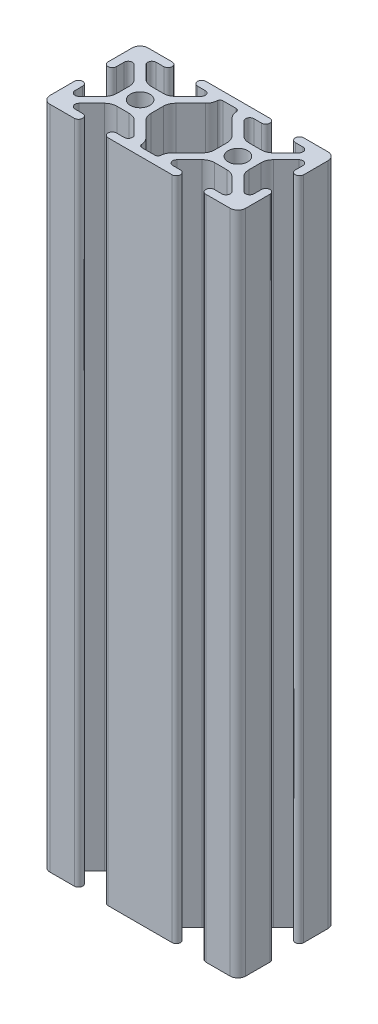
from build123d import *

# Parameters (mm, degrees)
SKETCH11_R                             = 2.5
F_25_SERIES_EXTRUSIONS_25_2550_1_DEPTH = 170


with BuildPart() as part:
    # Sketch11 → 25 series extrusions 25-2550(1) (new body)
    with BuildSketch(Plane(origin=(0, 0, 0), x_dir=(-1, 0, 0), z_dir=(0, 1, 0))):
        with BuildLine():
            Line((8.185, 12.5), (-8.185, 12.5))
            ThreePointArc((-8.185, 12.5), (-9.25, 11.435), (-8.185, 10.37))
            Line((-8.185, 10.37), (-6.227198013, 10.37))
            ThreePointArc((-6.227198013, 10.37), (-5.236616214, 9.708114403), (-5.469039527, 8.539643501))
            Line((-5.469039527, 8.539643501), (-8.697639148, 5.311043881))
            ThreePointArc((-8.697639148, 5.311043881), (-9.72768328, 4.622790395), (-10.942703178, 4.381107911))
            Line((-10.942703178, 4.381107911), (-14.057296822, 4.381107911))
            ThreePointArc((-14.057296822, 4.381107911), (-15.27231672, 4.622790395), (-16.302360852, 5.311043881))
            Line((-16.302360852, 5.311043881), (-19.530960473, 8.539643501))
            ThreePointArc((-19.530960473, 8.539643501), (-19.763383786, 9.708114403), (-18.772801987, 10.37))
            Line((-18.772801987, 10.37), (-16.815, 10.37))
            ThreePointArc((-16.815, 10.37), (-15.75, 11.435), (-16.815, 12.5))
            Line((-16.815, 12.5), (-23, 12.5))
            ThreePointArc((-23, 12.5), (-24.414213562, 11.914213562), (-25, 10.5))
            Line((-25, 10.5), (-25, 4.315))
            ThreePointArc((-25, 4.315), (-23.935, 3.25), (-22.87, 4.315))
            Line((-22.87, 4.315), (-22.87, 6.272801987))
            ThreePointArc((-22.87, 6.272801987), (-22.208114403, 7.263383786), (-21.039643501, 7.030960473))
            Line((-21.039643501, 7.030960473), (-17.811043881, 3.802360852))
            ThreePointArc((-17.811043881, 3.802360852), (-17.122790395, 2.77231672), (-16.881107911, 1.557296822))
            Line((-16.881107911, 1.557296822), (-16.881107911, -1.557296822))
            ThreePointArc((-16.881107911, -1.557296822), (-17.122790395, -2.77231672), (-17.811043881, -3.802360852))
            Line((-17.811043881, -3.802360852), (-21.039643501, -7.030960473))
            ThreePointArc((-21.039643501, -7.030960473), (-22.208114403, -7.263383786), (-22.87, -6.272801987))
            Line((-22.87, -6.272801987), (-22.87, -4.315))
            ThreePointArc((-22.87, -4.315), (-23.935, -3.25), (-25, -4.315))
            Line((-25, -4.315), (-25, -10.5))
            ThreePointArc((-25, -10.5), (-24.414213562, -11.914213562), (-23, -12.5))
            Line((-23, -12.5), (-16.815, -12.5))
            ThreePointArc((-16.815, -12.5), (-15.75, -11.435), (-16.815, -10.37))
            Line((-16.815, -10.37), (-18.772801987, -10.37))
            ThreePointArc((-18.772801987, -10.37), (-19.763383786, -9.708114403), (-19.530960473, -8.539643501))
            Line((-19.530960473, -8.539643501), (-16.302360852, -5.311043881))
            ThreePointArc((-16.302360852, -5.311043881), (-15.27231672, -4.622790395), (-14.057296822, -4.381107911))
            Line((-14.057296822, -4.381107911), (-10.942703178, -4.381107911))
            ThreePointArc((-10.942703178, -4.381107911), (-9.72768328, -4.622790395), (-8.697639148, -5.311043881))
            Line((-8.697639148, -5.311043881), (-5.469039527, -8.539643501))
            ThreePointArc((-5.469039527, -8.539643501), (-5.236616214, -9.708114403), (-6.227198013, -10.37))
            Line((-6.227198013, -10.37), (-8.185, -10.37))
            ThreePointArc((-8.185, -10.37), (-9.25, -11.435), (-8.185, -12.5))
            Line((-8.185, -12.5), (8.185, -12.5))
            ThreePointArc((8.185, -12.5), (9.25, -11.435), (8.185, -10.37))
            Line((8.185, -10.37), (6.227198013, -10.37))
            ThreePointArc((6.227198013, -10.37), (5.236616214, -9.708114403), (5.469039527, -8.539643501))
            Line((5.469039527, -8.539643501), (8.697639148, -5.311043881))
            ThreePointArc((8.697639148, -5.311043881), (9.72768328, -4.622790395), (10.942703178, -4.381107911))
            Line((10.942703178, -4.381107911), (14.057296822, -4.381107911))
            ThreePointArc((14.057296822, -4.381107911), (15.27231672, -4.622790395), (16.302360852, -5.311043881))
            Line((16.302360852, -5.311043881), (19.530960473, -8.539643501))
            ThreePointArc((19.530960473, -8.539643501), (19.763383786, -9.708114403), (18.772801987, -10.37))
            Line((18.772801987, -10.37), (16.815, -10.37))
            ThreePointArc((16.815, -10.37), (15.75, -11.435), (16.815, -12.5))
            Line((16.815, -12.5), (23, -12.5))
            ThreePointArc((23, -12.5), (24.414213562, -11.914213562), (25, -10.5))
            Line((25, -10.5), (25, -4.315))
            ThreePointArc((25, -4.315), (23.935, -3.25), (22.87, -4.315))
            Line((22.87, -4.315), (22.87, -6.272801987))
            ThreePointArc((22.87, -6.272801987), (22.208114403, -7.263383786), (21.039643501, -7.030960473))
            Line((21.039643501, -7.030960473), (17.811043881, -3.802360852))
            ThreePointArc((17.811043881, -3.802360852), (17.122790395, -2.77231672), (16.881107911, -1.557296822))
            Line((16.881107911, -1.557296822), (16.881107911, 1.557296822))
            ThreePointArc((16.881107911, 1.557296822), (17.122790395, 2.77231672), (17.811043881, 3.802360852))
            Line((17.811043881, 3.802360852), (21.039643501, 7.030960473))
            ThreePointArc((21.039643501, 7.030960473), (22.208114403, 7.263383786), (22.87, 6.272801987))
            Line((22.87, 6.272801987), (22.87, 4.315))
            ThreePointArc((22.87, 4.315), (23.935, 3.25), (25, 4.315))
            Line((25, 4.315), (25, 10.5))
            ThreePointArc((25, 10.5), (24.414213562, 11.914213562), (23, 12.5))
            Line((23, 12.5), (16.815, 12.5))
            ThreePointArc((16.815, 12.5), (15.75, 11.435), (16.815, 10.37))
            Line((16.815, 10.37), (18.772801987, 10.37))
            ThreePointArc((18.772801987, 10.37), (19.763383786, 9.708114403), (19.530960473, 8.539643501))
            Line((19.530960473, 8.539643501), (16.302360852, 5.311043881))
            ThreePointArc((16.302360852, 5.311043881), (15.27231672, 4.622790395), (14.057296822, 4.381107911))
            Line((14.057296822, 4.381107911), (10.942703178, 4.381107911))
            ThreePointArc((10.942703178, 4.381107911), (9.72768328, 4.622790395), (8.697639148, 5.311043881))
            Line((8.697639148, 5.311043881), (5.469039527, 8.539643501))
            ThreePointArc((5.469039527, 8.539643501), (5.236616214, 9.708114403), (6.227198013, 10.37))
            Line((6.227198013, 10.37), (8.185, 10.37))
            ThreePointArc((8.185, 10.37), (9.25, 11.435), (8.185, 12.5))
        make_face()
        with Locations((-12.5, 0)):
            Circle(SKETCH11_R, mode=Mode.SUBTRACT)
        with Locations((12.5, 0)):
            Circle(SKETCH11_R, mode=Mode.SUBTRACT)
        with BuildLine():
            Line((-1.678781255, 10.37), (1.678781255, 10.37))
            ThreePointArc((1.678781255, 10.37), (2.198638297, 10.16512894), (2.438958165, 9.660678886))
            ThreePointArc((2.438958165, 9.660678886), (2.716823224, 8.564426963), (3.361297928, 7.635110212))
            Line((3.361297928, 7.635110212), (7.191171941, 3.805236199))
            ThreePointArc((7.191171941, 3.805236199), (7.879425427, 2.775192067), (8.121107911, 1.560172169))
            Line((8.121107911, 1.560172169), (8.121107911, -1.560172169))
            ThreePointArc((8.121107911, -1.560172169), (7.879425427, -2.775192067), (7.191171941, -3.805236199))
            Line((7.191171941, -3.805236199), (3.361297928, -7.635110212))
            ThreePointArc((3.361297928, -7.635110212), (2.716823224, -8.564426963), (2.438958165, -9.660678886))
            ThreePointArc((2.438958165, -9.660678886), (2.198638297, -10.16512894), (1.678781255, -10.37))
            Line((1.678781255, -10.37), (-1.678781255, -10.37))
            ThreePointArc((-1.678781255, -10.37), (-2.198638297, -10.16512894), (-2.438958165, -9.660678886))
            ThreePointArc((-2.438958165, -9.660678886), (-2.716823224, -8.564426963), (-3.361297928, -7.635110212))
            Line((-3.361297928, -7.635110212), (-7.191171941, -3.805236199))
            ThreePointArc((-7.191171941, -3.805236199), (-7.879425427, -2.775192067), (-8.121107911, -1.560172169))
            Line((-8.121107911, -1.560172169), (-8.121107911, 1.560172169))
            ThreePointArc((-8.121107911, 1.560172169), (-7.879425427, 2.775192067), (-7.191171941, 3.805236199))
            Line((-7.191171941, 3.805236199), (-3.361297928, 7.635110212))
            ThreePointArc((-3.361297928, 7.635110212), (-2.716823224, 8.564426963), (-2.438958165, 9.660678886))
            ThreePointArc((-2.438958165, 9.660678886), (-2.198638297, 10.16512894), (-1.678781255, 10.37))
        make_face(mode=Mode.SUBTRACT)
    extrude(amount=F_25_SERIES_EXTRUSIONS_25_2550_1_DEPTH)


solid = part.part
